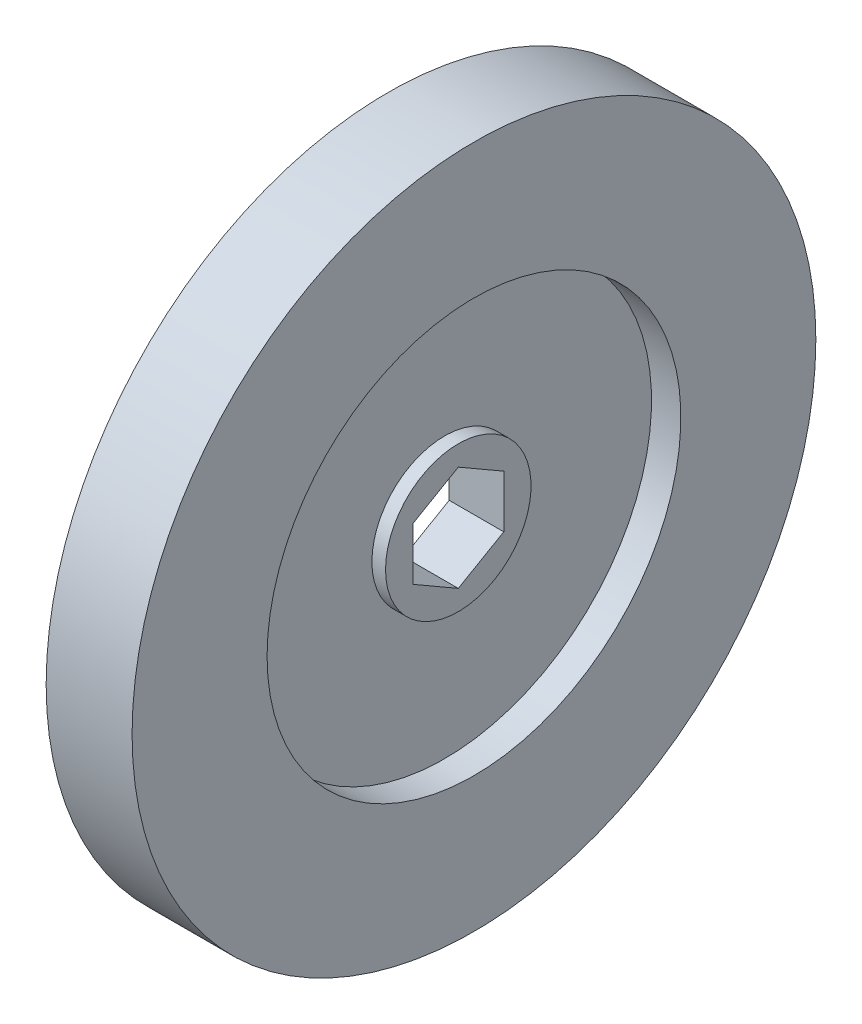
from build123d import *

# Parameters (mm, degrees)
ENL_V_MAT_EXTRU_1_DEPTH = 69.232612173


with BuildPart() as part:
    # Esquisse1 → Révolution1 (revolve)
    with BuildSketch(Plane.XY, mode=Mode.PRIVATE) as r_volution1_sk:
        Polygon((-6, 47.746482928), (6, 47.746482928), (6, 28.8925), (1.905, 28.8925), (1.905, 10.16), (3.81, 10.16), (3.81, 0), (-3.81, 0), (-3.81, 10.16), (-1.905, 10.16), (-1.905, 28.8925), (-6, 28.8925), align=None)
    revolve(r_volution1_sk.sketch.rotate(Axis((-12.56603466, 0, 0), (1, 0, 0)), 90), axis=Axis((-12.56603466, 0, 0), (1, 0, 0)))

    # Esquisse2 → Enlèv. mat.-Extru.1 (cut, through all)
    with BuildSketch(Plane(origin=(3.81, 0, 0), x_dir=(0, 0, -1), z_dir=(1, 0, 0))):
        Polygon((0, 7.332348419), (-6.35, 3.666174209), (-6.35, -3.666174209), (0, -7.332348419), (6.35, -3.666174209), (6.35, 3.666174209), align=None)
    extrude(amount=-ENL_V_MAT_EXTRU_1_DEPTH, mode=Mode.SUBTRACT)


solid = part.part
